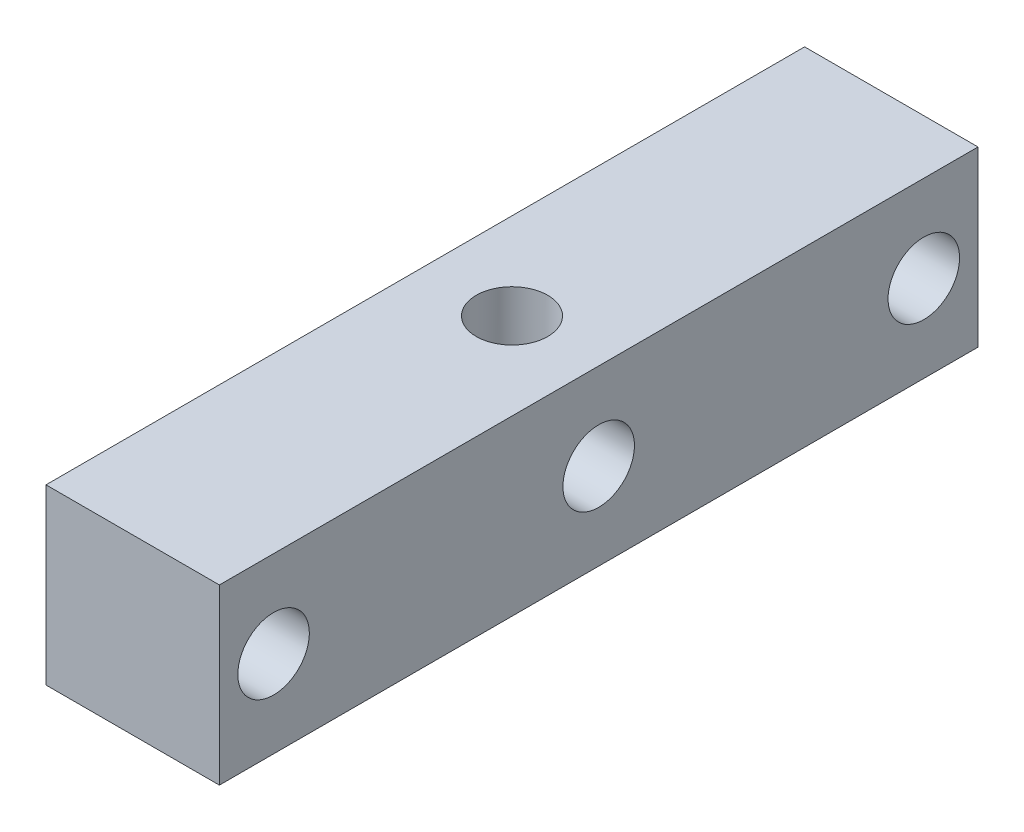
from build123d import *

# Parameters (mm, degrees)
SKETCH_1_W          = 8
SKETCH_1_H          = 8
EXTRUDE_1_DEPTH     = 35
SKETCH_2_R          = 1.65
CUT_EXTRUDE_1_DEPTH = 40
SKETCH_3_R          = 1.65
CUT_EXTRUDE_2_DEPTH = 40
SKETCH_6_R          = 1.5
CUT_EXTRUDE_4_DEPTH = 37.783148315
HOLE_WIZARD_M4_3_D  = 3.3


with BuildPart() as part:
    # 草图1 → 凸台-拉伸1 (new body)
    with BuildSketch(Plane.XY):
        with Locations((4, 4)):
            Rectangle(SKETCH_1_W, SKETCH_1_H)
    extrude(amount=EXTRUDE_1_DEPTH)

    # 草图2 → 切除-拉伸1 (cut)
    with BuildSketch(Plane(origin=(8, 0, 0), x_dir=(0, 0, -1), z_dir=(1, 0, 0))):
        with Locations(Location((-32.5, 4, 0), (0, 0, 90))):
            Circle(SKETCH_2_R)
        with Locations(Location((-2.5, 4, 0), (0, 0, 90))):
            Circle(SKETCH_2_R)
    extrude(amount=-CUT_EXTRUDE_1_DEPTH, mode=Mode.SUBTRACT)

    # 草图3 → 切除-拉伸2 (cut)
    with BuildSketch(Plane(origin=(0, 8, 0), x_dir=(1, 0, 0), z_dir=(0, 1, 0))):
        with Locations(Location((4, -17.5, 0), (0, 0, 270))):
            Circle(SKETCH_3_R)
    extrude(amount=-CUT_EXTRUDE_2_DEPTH, mode=Mode.SUBTRACT)

    # 草图6 → 切除-拉伸4 (cut, through all)
    with BuildSketch(Plane(origin=(8, 0, 0), x_dir=(0, 0, -1), z_dir=(1, 0, 0))):
        with Locations(Location((-17.5, 4, 0), (0, 0, 90))):
            Circle(SKETCH_6_R)
    extrude(amount=-CUT_EXTRUDE_4_DEPTH, mode=Mode.SUBTRACT)

    # M4 螺纹孔3 (through all)
    with Locations(Plane(origin=(8, 0, 0), x_dir=(0, 0, -1), z_dir=(1, 0, 0))):
        with Locations((-17.5, 4)):
            Hole(HOLE_WIZARD_M4_3_D / 2)


solid = part.part
